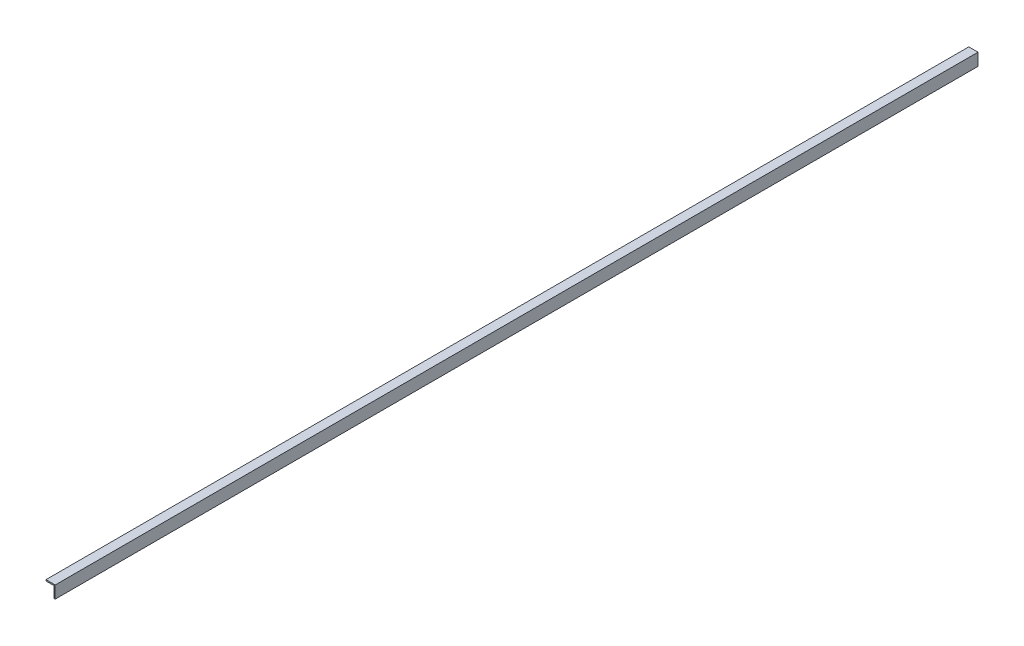
from build123d import *

# Parameters (mm, degrees)
EXTRUDE_1_DEPTH = 750


with BuildPart() as part:
    # 草图1 → 凸台-拉伸1 (new, symmetric)
    with BuildSketch(Plane.XY):
        Polygon((0, 0), (15, 0), (15, -20), (13, -20), (13, -2), (0, -2), align=None)
    extrude(amount=EXTRUDE_1_DEPTH, both=True)


solid = part.part
